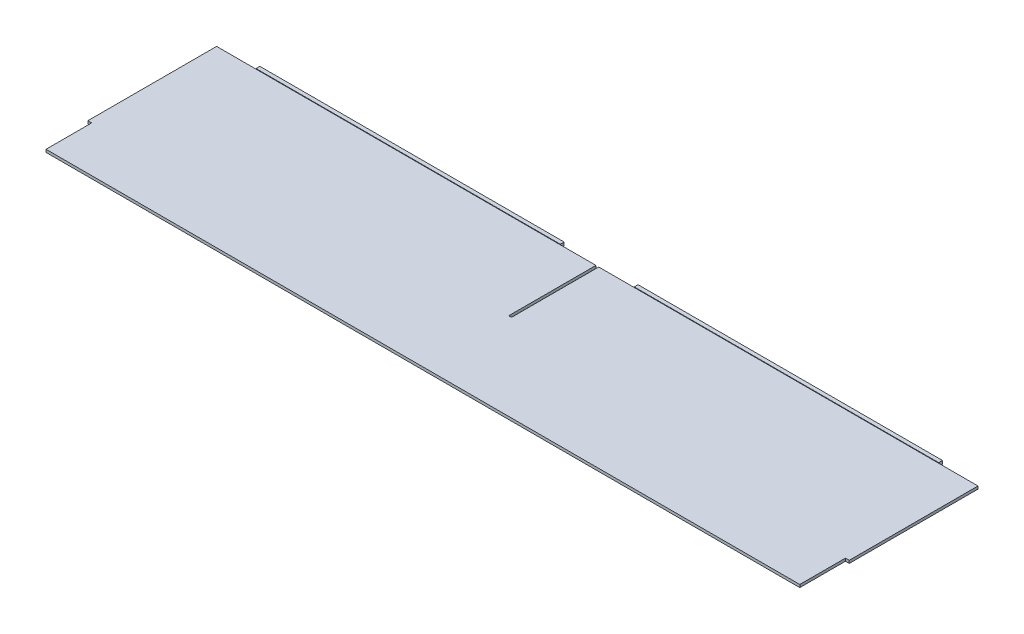
from build123d import *

# Parameters (mm, degrees)
SKETCH1_W           = 635.3556
SKETCH1_H           = 145.542
BOSS_EXTRUDE1_DEPTH = 1.143
SKETCH2_W           = 254
SKETCH2_H           = 2.7305
BOSS_EXTRUDE2_DEPTH = 3.175
SKETCH3_W           = 3.175
SKETCH3_H           = 38.1
CUT_EXTRUDE1_DEPTH  = 327.641141253
SKETCH4_W           = 2.3368
SKETCH4_H           = 72.771
CUT_EXTRUDE2_DEPTH  = 327.641141253


with BuildPart() as part:
    # Sketch1 → Boss-Extrude1 (new, symmetric)
    with BuildSketch(Plane(origin=(0, 0, 0), x_dir=(1, 0, 0), z_dir=(0, 1, 0))):
        Rectangle(SKETCH1_W, SKETCH1_H)
    extrude(amount=BOSS_EXTRUDE1_DEPTH, both=True)

    # Sketch2 → Boss-Extrude2 (add)
    with BuildSketch(Plane(origin=(0, 0, -72.771), x_dir=(-1, 0, 0), z_dir=(0, 0, -1))):
        with Locations((-157.8229, 0.22225)):
            Rectangle(SKETCH2_W, SKETCH2_H)
        with Locations((157.8229, 0.22225)):
            Rectangle(SKETCH2_W, SKETCH2_H)
    extrude(amount=BOSS_EXTRUDE2_DEPTH)

    # Sketch3 → Cut-Extrude1 (cut, through all)
    with BuildSketch(Plane.XZ.offset(1.143)):
        with Locations((-316.0903, 53.721)):
            Rectangle(SKETCH3_W, SKETCH3_H)
    cut_extrude1 = extrude(amount=-CUT_EXTRUDE1_DEPTH, mode=Mode.SUBTRACT)

    # Mirror1: Cut-Extrude1 across plane
    add(cut_extrude1.mirror(Plane(origin=(0, 0, 0), x_dir=(0, 0, 1), z_dir=(1, 0, 0))), mode=Mode.SUBTRACT)

    # Sketch4 → Cut-Extrude2 (cut, through all)
    with BuildSketch(Plane.XZ.offset(1.143)):
        with Locations((0.0254, -36.3855)):
            Rectangle(SKETCH4_W, SKETCH4_H)
    extrude(amount=-CUT_EXTRUDE2_DEPTH, mode=Mode.SUBTRACT)


solid = part.part
